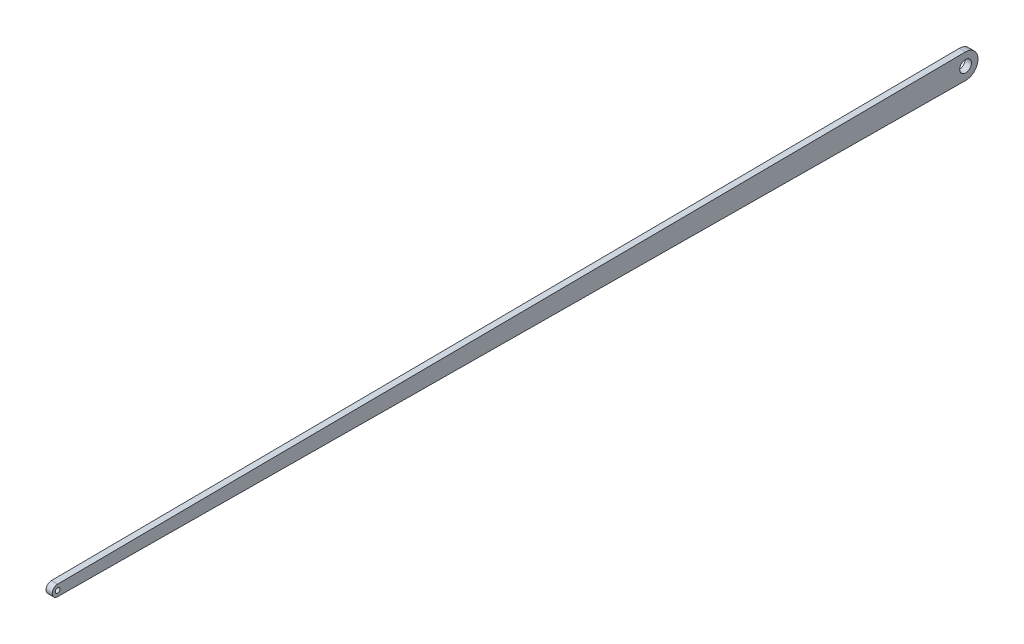
from build123d import *

# Parameters (mm, degrees)
SKETCH1_R           = 46.875
SKETCH1_R_2         = 18.75
BOSS_EXTRUDE1_DEPTH = 50


with BuildPart() as part:
    # Sketch1 → Boss-Extrude1 (new body)
    with BuildSketch(Plane(origin=(0, 0, 0), x_dir=(0, 0, -1), z_dir=(1, 0, 0))):
        with BuildLine():
            Line((-7300, -43.75), (0, -100))
            ThreePointArc((0, -100), (100, 0), (0, 100))
            Line((0, 100), (-7300, 43.75))
            ThreePointArc((-7300, 43.75), (-7343.75, 0), (-7300, -43.75))
        make_face()
        Circle(SKETCH1_R, mode=Mode.SUBTRACT)
        with Locations((-7300, 0)):
            Circle(SKETCH1_R_2, mode=Mode.SUBTRACT)
    extrude(amount=BOSS_EXTRUDE1_DEPTH)


solid = part.part
